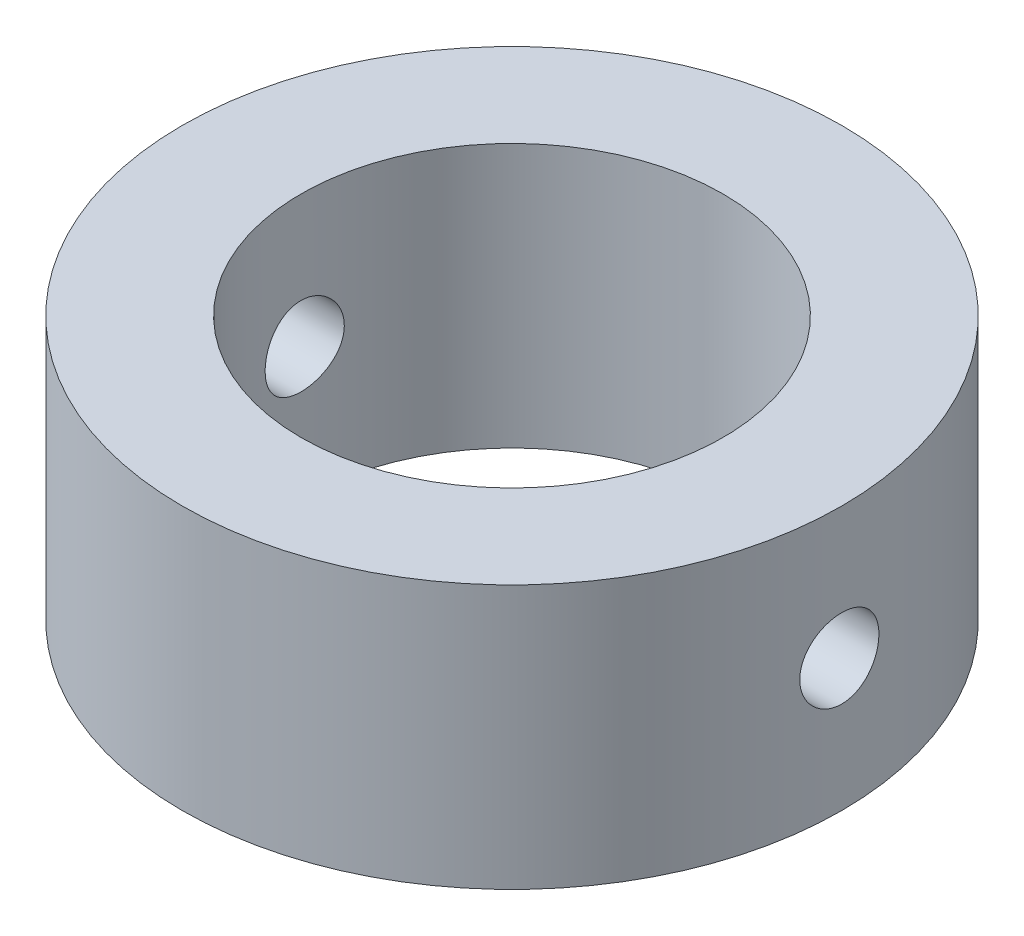
from build123d import *

# Parameters (mm, degrees)
SKETCH1_R           = 12.5
SKETCH1_R_2         = 8
BOSS_EXTRUDE1_DEPTH = 10
SKETCH3_R           = 1.5
CUT_EXTRUDE1_DEPTH  = 30.685855218


with BuildPart() as part:
    # Sketch1 → Boss-Extrude1 (new body)
    with BuildSketch(Plane(origin=(0, 0, 0), x_dir=(1, 0, 0), z_dir=(0, 1, 0))):
        with Locations(Location((0, 0, 0), (0, 0, 270))):
            Circle(SKETCH1_R)
        with Locations(Location((0, 0, 0), (0, 0, 270))):
            Circle(SKETCH1_R_2, mode=Mode.SUBTRACT)
    extrude(amount=BOSS_EXTRUDE1_DEPTH)

    # Sketch3 → Cut-Extrude1 (cut, through all)
    with BuildSketch(Plane.ZY.offset(12.5)):
        with Locations((0, 5)):
            Circle(SKETCH3_R)
    extrude(amount=-CUT_EXTRUDE1_DEPTH, mode=Mode.SUBTRACT)


solid = part.part
